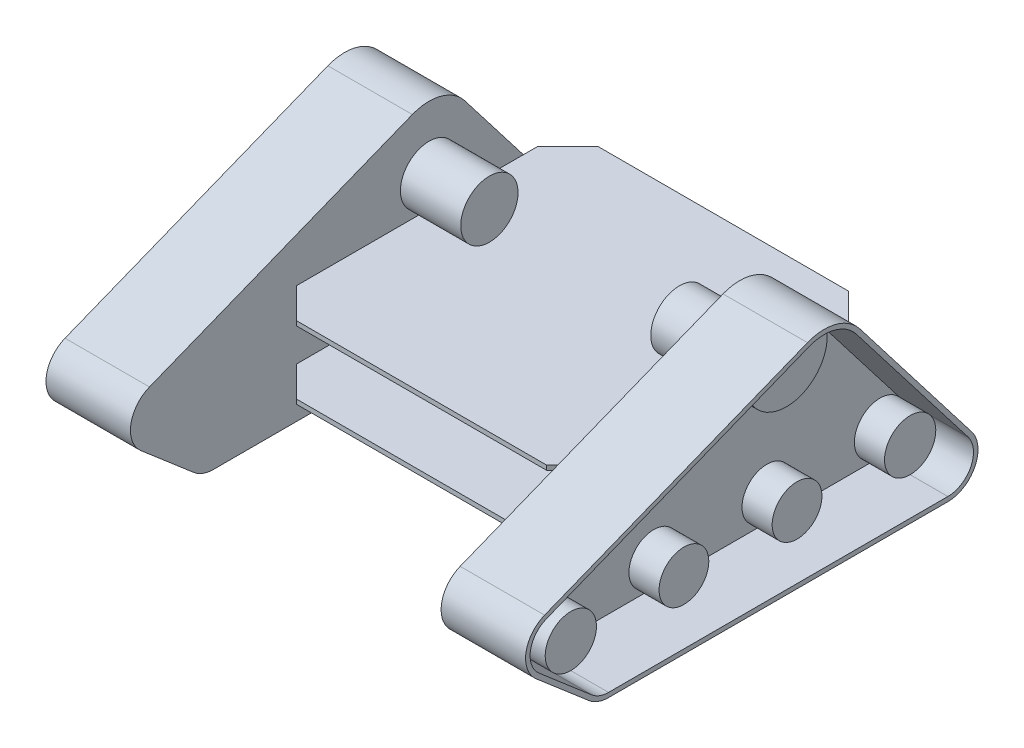
from build123d import *

# Parameters (mm, degrees)
SKETCH_1_W          = 200
SKETCH_1_H          = 3
EXTRUDE_1_DEPTH     = 103
EXTRUDE_1_2_DEPTH   = 103
CHAMFER_1_SIZE      = 20
CHAMFER_2_SIZE      = 20
EXTRUDE_2_DEPTH     = 3
EXTRUDE_START       = 3
EXTRUDE_3_DEPTH     = 3
EXTRUDE_5_DEPTH     = 53
CUT_EXTRUDE_1_DEPTH = 45
EXTRUDE_START_2     = 53
EXTRUDE_6_DEPTH     = 53
CUT_EXTRUDE_START   = -45
CUT_EXTRUDE_3_DEPTH = 45
EXTRUDE_START_3     = 20
SKETCH_10_R         = 27
SKETCH_10_R_2       = 17
SKETCH_10_R_3       = 16.5
EXTRUDE_8_DEPTH     = 20
SKETCH_11_R         = 27
SKETCH_11_R_2       = 17
SKETCH_11_R_3       = 16.5
EXTRUDE_9_DEPTH     = 20
SKETCH_12_R         = 19
EXTRUDE_10_DEPTH    = 40
EXTRUDE_START_4     = 40
SKETCH_13_R         = 19
EXTRUDE_11_DEPTH    = 40


with BuildPart() as part:
    # 草图1 → 凸台-拉伸1 (new, symmetric)
    with BuildSketch(Plane(origin=(0, 0, 0), x_dir=(0, 0, -1), z_dir=(1, 0, 0))):
        Rectangle(SKETCH_1_W, SKETCH_1_H)
    extrude(amount=EXTRUDE_1_DEPTH, both=True)

    # 倒角2
    chamfer_2_edges = [part.edges().sort_by_distance(p)[0] for p in [
        (103, 0, 100),
        (103, 0, -100),
        (-103, 0, 100),
        (-103, 0, -100),
    ]]
    chamfer(chamfer_2_edges, length=CHAMFER_2_SIZE)



with BuildPart() as body_2:
    # 草图1 → Extrude 1 2 (new, symmetric)
    with BuildSketch(Plane(origin=(0, 0, 0), x_dir=(0, 0, -1), z_dir=(1, 0, 0))):
        with Locations((0, 45)):
            Rectangle(SKETCH_1_W, SKETCH_1_H)
    extrude(amount=EXTRUDE_1_2_DEPTH, both=True)

    # 倒角1
    chamfer_1_edges = [body_2.edges().sort_by_distance(p)[0] for p in [
        (103, 45, -100),
        (103, 45, 100),
        (-103, 45, -100),
        (-103, 45, 100),
    ]]
    chamfer(chamfer_1_edges, length=CHAMFER_1_SIZE)


with BuildPart() as part_1:
    add(part.part)

    add(body_2.part)  # 凸台-拉伸2 merges body 2
    # 草图2 → 凸台-拉伸2 (add)
    with BuildSketch(Plane(origin=(103, 0, 0), x_dir=(0, 0, -1), z_dir=(1, 0, 0))):
        with BuildLine():
            Line((105.840291615, 0.710043471), (31.760437422, 96.815065207))
            ThreePointArc((31.760437422, 96.815065207), (15.940085812, 107.430175203), (-3.082450225, 106.377935666))
            Line((-3.082450225, 106.377935666), (-177.38830015, 37.085290444))
            ThreePointArc((-177.38830015, 37.085290444), (-189.727961496, 21.787481591), (-183.015827469, 3.314867953))
            Line((-183.015827469, 3.314867953), (-148.015827469, -26.685132047))
            ThreePointArc((-148.015827469, -26.685132047), (-141.938924955, -30.257700298), (-135, -31.5))
            Line((-135, -31.5), (90, -31.5))
            ThreePointArc((90, -31.5), (107.947156731, -20.326073039), (105.840291615, 0.710043471))
        make_face()
    extrude(amount=EXTRUDE_2_DEPTH)

    # 草图3 → 凸台-拉伸3 (add)
    with BuildSketch(Plane.ZY.offset(103).offset(EXTRUDE_START)):
        with BuildLine():
            Line((-105.840291615, 0.710043471), (-31.760437422, 96.815065207))
            ThreePointArc((-31.760437422, 96.815065207), (-15.940085812, 107.430175203), (3.082450225, 106.377935666))
            Line((3.082450225, 106.377935666), (177.38830015, 37.085290444))
            ThreePointArc((177.38830015, 37.085290444), (189.727961496, 21.787481591), (183.015827469, 3.314867953))
            Line((183.015827469, 3.314867953), (148.015827469, -26.685132047))
            ThreePointArc((148.015827469, -26.685132047), (141.938924955, -30.257700298), (135, -31.5))
            Line((135, -31.5), (-90, -31.5))
            ThreePointArc((-90, -31.5), (-107.947156731, -20.326073039), (-105.840291615, 0.710043471))
        make_face()
    extrude(amount=-EXTRUDE_3_DEPTH)

    # 草图4 → 凸台-拉伸5 (add)
    with BuildSketch(Plane(origin=(106, 0, 0), x_dir=(0, 0, -1), z_dir=(1, 0, 0))):
        with BuildLine():
            Line((-3.082450225, 106.377935666), (-177.38830015, 37.085290444))
            ThreePointArc((-177.38830015, 37.085290444), (-189.727961496, 21.787481591), (-183.015827469, 3.314867953))
            Line((-183.015827469, 3.314867953), (-148.015827469, -26.685132047))
            ThreePointArc((-148.015827469, -26.685132047), (-141.938924955, -30.257700298), (-135, -31.5))
            Line((-135, -31.5), (90, -31.5))
            ThreePointArc((90, -31.5), (107.947156731, -20.326073039), (105.840291615, 0.710043471))
            Line((105.840291615, 0.710043471), (31.760437422, 96.815065207))
            ThreePointArc((31.760437422, 96.815065207), (15.940085812, 107.430175203), (-3.082450225, 106.377935666))
        make_face()
    extrude(amount=EXTRUDE_5_DEPTH)

    # 草图6 → 切除-拉伸1 (cut)
    with BuildSketch(Plane(origin=(159, 0, 0), x_dir=(0, 0, -1), z_dir=(1, 0, 0))):
        with BuildLine():
            Line((-176.280055127, 34.297496878), (-1.974205202, 103.5901421))
            ThreePointArc((-1.974205202, 103.5901421), (15.146077231, 104.537157683), (29.38439368, 94.983558686))
            Line((29.38439368, 94.983558686), (103.464247872, -1.12146305))
            ThreePointArc((103.464247872, -1.12146305), (105.255083221, -19.002162083), (90, -28.5))
            Line((90, -28.5), (-135, -28.5))
            ThreePointArc((-135, -28.5), (-140.898086211, -27.444045253), (-146.063453349, -24.40736224))
            Line((-146.063453349, -24.40736224), (-181.063453349, 5.59263776))
            ThreePointArc((-181.063453349, 5.59263776), (-186.768767272, 21.294359353), (-176.280055127, 34.297496878))
        make_face()
    extrude(amount=-CUT_EXTRUDE_1_DEPTH, mode=Mode.SUBTRACT)

    # 草图8 → 凸台-拉伸6 (add)
    with BuildSketch(Plane.ZY.offset(106).offset(EXTRUDE_START_2)):
        with BuildLine():
            Line((-31.760437422, 96.815065207), (-105.840291615, 0.710043471))
            ThreePointArc((-105.840291615, 0.710043471), (-107.947156731, -20.326073039), (-90, -31.5))
            Line((-90, -31.5), (135, -31.5))
            ThreePointArc((135, -31.5), (141.938924955, -30.257700298), (148.015827469, -26.685132047))
            Line((148.015827469, -26.685132047), (183.015827469, 3.314867953))
            ThreePointArc((183.015827469, 3.314867953), (189.727961496, 21.787481591), (177.38830015, 37.085290444))
            Line((177.38830015, 37.085290444), (3.082450225, 106.377935666))
            ThreePointArc((3.082450225, 106.377935666), (-15.940085812, 107.430175203), (-31.760437422, 96.815065207))
        make_face()
    extrude(amount=-EXTRUDE_6_DEPTH)

    # 草图9 → 切除-拉伸3 (cut)
    with BuildSketch(Plane.ZY.offset(159).offset(CUT_EXTRUDE_START)):
        with BuildLine():
            Line((-29.38439368, 94.983558686), (-103.464247872, -1.12146305))
            ThreePointArc((-103.464247872, -1.12146305), (-105.255083221, -19.002162083), (-90, -28.5))
            Line((-90, -28.5), (135, -28.5))
            ThreePointArc((135, -28.5), (140.898086211, -27.444045253), (146.063453349, -24.40736224))
            Line((146.063453349, -24.40736224), (181.063453349, 5.59263776))
            ThreePointArc((181.063453349, 5.59263776), (186.768767272, 21.294359353), (176.280055127, 34.297496878))
            Line((176.280055127, 34.297496878), (1.974205202, 103.5901421))
            ThreePointArc((1.974205202, 103.5901421), (-15.146077231, 104.537157683), (-29.38439368, 94.983558686))
        make_face()
    extrude(amount=CUT_EXTRUDE_3_DEPTH, mode=Mode.SUBTRACT)

    # 草图10 → 凸台-拉伸8 (add)
    with BuildSketch(Plane(origin=(114, 0, 0), x_dir=(0, 0, -1), z_dir=(1, 0, 0)).offset(EXTRUDE_START_3)):
        with Locations((8, 78.5)):
            Circle(SKETCH_10_R)
        with Locations((-170, 18.5)):
            Circle(SKETCH_10_R_2)
        with Locations((-135, -11.5)):
            Circle(SKETCH_10_R_2)
        with Locations((-60, -11.5)):
            Circle(SKETCH_10_R_3)
        with Locations((15, -11.5)):
            Circle(SKETCH_10_R_3)
        with Locations((90, -11.5)):
            Circle(SKETCH_10_R_2)
    extrude(amount=-EXTRUDE_8_DEPTH)

    # 草图11 → 凸台-拉伸9 (add)
    with BuildSketch(Plane.ZY.offset(114)):
        with Locations((-8, 78.5)):
            Circle(SKETCH_11_R)
        with Locations((-90, -11.5)):
            Circle(SKETCH_11_R_2)
        with Locations(Location((-15, -11.5, 0), (0, 0, 180))):
            Circle(SKETCH_11_R_3)
        with Locations(Location((60, -11.5, 0), (0, 0, 180))):
            Circle(SKETCH_11_R_3)
        with Locations((135, -11.5)):
            Circle(SKETCH_11_R_2)
        with Locations((170, 18.5)):
            Circle(SKETCH_11_R_2)
    extrude(amount=EXTRUDE_9_DEPTH)

    # 草图12 → 凸台-拉伸10 (add)
    with BuildSketch(Plane.ZY.offset(-103)):
        with Locations(Location((-8, 66.5, 0), (0, 0, 180))):
            Circle(SKETCH_12_R)
    extrude(amount=EXTRUDE_10_DEPTH)

    # 草图13 → 凸台-拉伸11 (add)
    with BuildSketch(Plane(origin=(-103, 0, 0), x_dir=(0, 0, -1), z_dir=(1, 0, 0)).offset(EXTRUDE_START_4)):
        with Locations((8, 66.5)):
            Circle(SKETCH_13_R)
    extrude(amount=-EXTRUDE_11_DEPTH)


solid = part_1.part
